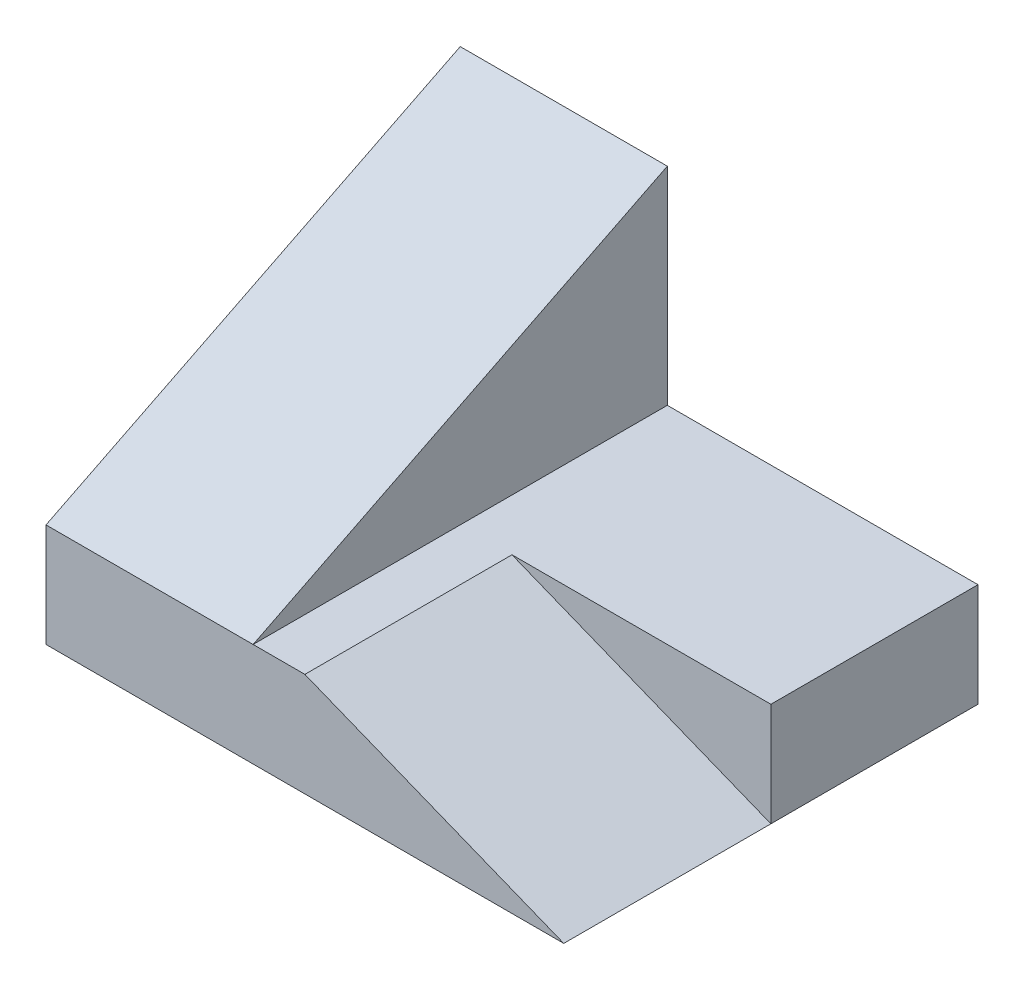
from build123d import *

# Parameters (mm, degrees)
SKETCH1_W           = 50
SKETCH1_H           = 40
BOSS_EXTRUDE1_DEPTH = 10
SKETCH2_W           = 20
SKETCH2_H           = 40
BOSS_EXTRUDE2_DEPTH = 20
CUT_EXTRUDE1_DEPTH  = 20
CUT_EXTRUDE5_DEPTH  = 20


with BuildPart() as part:
    # Sketch1 → Boss-Extrude1 (new body)
    with BuildSketch(Plane(origin=(0, 0, 0), x_dir=(1, 0, 0), z_dir=(0, 1, 0))):
        Rectangle(SKETCH1_W, SKETCH1_H)
    extrude(amount=BOSS_EXTRUDE1_DEPTH)

    # Sketch2 → Boss-Extrude2 (add)
    with BuildSketch(Plane(origin=(0, 10, 0), x_dir=(1, 0, 0), z_dir=(0, 1, 0))):
        with Locations((-15, 0)):
            Rectangle(SKETCH2_W, SKETCH2_H)
    extrude(amount=BOSS_EXTRUDE2_DEPTH)

    # Sketch3 → Cut-Extrude1 (cut)
    with BuildSketch(Plane(origin=(-5, 0, 0), x_dir=(0, 0, -1), z_dir=(1, 0, 0))):
        Polygon((20, 30), (-20, 10), (-20, 30), align=None)
    extrude(amount=-CUT_EXTRUDE1_DEPTH, mode=Mode.SUBTRACT)

    # Sketch5 → Cut-Extrude5 (cut)
    with BuildSketch(Plane.XY.offset(20)):
        Polygon((0, 10), (25, 0), (25, 10), align=None)
    extrude(amount=-CUT_EXTRUDE5_DEPTH, mode=Mode.SUBTRACT)


solid = part.part
